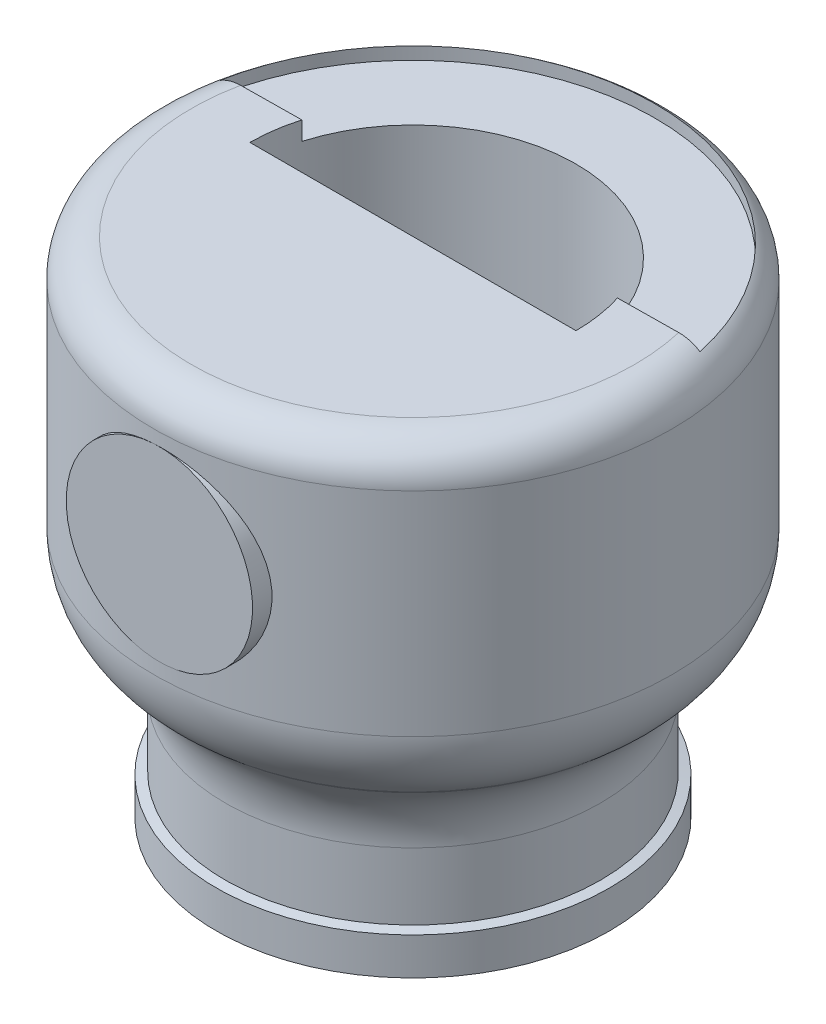
from build123d import *
from build123d.topology import SkipClean

# Parameters (mm, degrees)
SKETCH10_R              = 10
BOSS_EXTRUDE1_DEPTH     = 5
CUT_EXTRUDE3_DEPTH      = 45
CUT_EXTRUDE3_DEPTH_BACK = 20
CUT_EXTRUDE5_DEPTH      = 2


with BuildPart() as part:
    # Sketch1 → Revolve1 (revolve)
    with BuildSketch(Plane.XY):
        with BuildLine():
            Line((20.9, 0), (23.871591838, 0))
            Line((23.871591838, 0), (23.871591838, 4))
            Line((23.871591838, 4), (22.9, 4.236662843))
            Line((22.9, 4.236662843), (22.9, 11.404308102))
            ThreePointArc((22.9, 11.404308102), (23.83692213, 15.63049072), (26.472123903, 19.064752533))
            Line((26.472123903, 19.064752533), (26.988320528, 19.497892931))
            ThreePointArc((26.988320528, 19.497892931), (29.623522302, 22.932154745), (30.560444431, 27.158337362))
            Line((30.560444431, 27.158337362), (30.560444431, 50))
            ThreePointArc((30.560444431, 50), (29.388871556, 52.828427125), (26.560444431, 54))
            Line((26.560444431, 54), (2.764914955, 54))
            Line((2.764914955, 54), (2.764914955, 15))
            Line((2.764914955, 15), (19.9, 15))
            ThreePointArc((19.9, 15), (20.607106781, 14.707106781), (20.9, 14))
            Line((20.9, 14), (20.9, 0))
        make_face()
    revolve(axis=Axis((2.764914955, 7.821821657, 0), (0, 1, 0)))

    # Sketch10 → Boss-Extrude1 (add)
    with SkipClean():  # the faces are left unmerged after this step: merging them gives an invalid solid
        with BuildSketch(Plane.XY.offset(27.795529476)):
            with Locations((3.346345887, 38.658337362)):
                Circle(SKETCH10_R)
        extrude(amount=-BOSS_EXTRUDE1_DEPTH)

    # Sketch11 → Cut-Extrude3 (cut, two sides: drawn at the far end of the back side and taken through both)
    with SkipClean():  # the faces are left unmerged after this step: merging them gives an invalid solid
        with BuildSketch(Plane(origin=(0, 17, 0), x_dir=(1, 0, 0), z_dir=(0, 1, 0)).offset(-CUT_EXTRUDE3_DEPTH_BACK)):
            with BuildLine():
                Line((-14.735085045, 0), (20.264914955, 0))
                ThreePointArc((20.264914955, 0), (2.764914955, 17.5), (-14.735085045, 0))
            make_face()
        extrude(amount=CUT_EXTRUDE3_DEPTH + CUT_EXTRUDE3_DEPTH_BACK, mode=Mode.SUBTRACT)

    # Sketch9 → Cut-Extrude5 (cut)
    with SkipClean():  # the faces are left unmerged after this step: merging them gives an invalid solid
        with BuildSketch(Plane(origin=(0, 54, 0), x_dir=(1, 0, 0), z_dir=(0, 1, 0))):
            with BuildLine():
                Line((-22.791277346, 4.78341249), (28.205408486, 5.364819562))
                ThreePointArc((28.205408486, 5.364819562), (2.46851135, 25.998310424), (-22.791277346, 4.78341249))
            make_face()
        extrude(amount=-CUT_EXTRUDE5_DEPTH, mode=Mode.SUBTRACT)


solid = part.part
